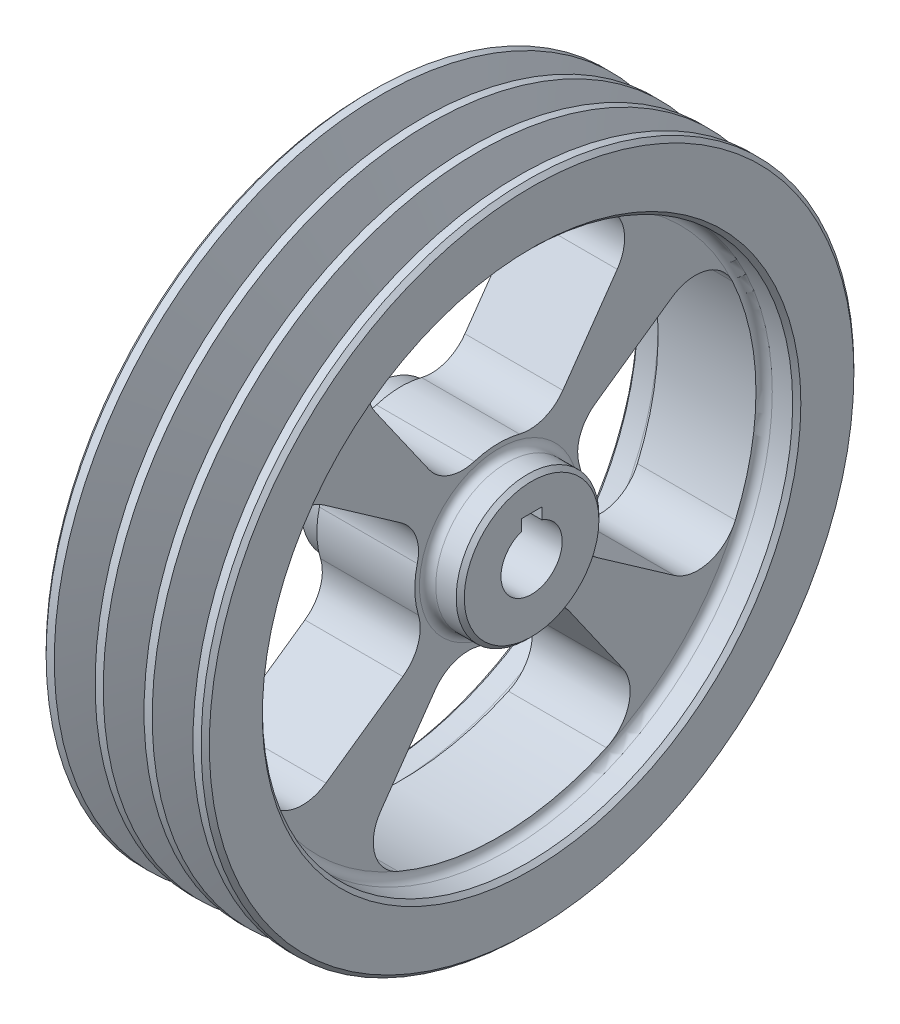
from build123d import *

# Parameters (mm, degrees)
FILLET1_R          = 2
CHAMFER1_SIZE      = 1
CUT_EXTRUDE1_DEPTH = 40
CIRPATTERN1_COUNT  = 4
SKETCH5_W          = 5
SKETCH5_H          = 5
CUT_EXTRUDE2_DEPTH = 121


with BuildPart() as part:
    # Sketch1 → Revolve1 (revolve)
    with BuildSketch(Plane(origin=(0, 0, 0), x_dir=(1, 0, 0), z_dir=(0, 1, 0))):
        Polygon((-12, 17.5), (-12, 65), (-20, 65), (-20, 80), (-17, 80), (-13.942693185, 70), (-10.057306815, 70), (-7, 80), (-5, 80), (-1.942693185, 70), (1.942693185, 70), (5, 80), (7, 80), (10.057306815, 70), (13.942693185, 70), (17, 80), (20, 80), (20, 65), (12, 65), (12, 17.5), (20, 17.5), (20, 7.5), (-20, 7.5), (-20, 17.5), align=None)
    revolve(axis=Axis((0, 0, 0), (-1, 0, 0)))

    # Fillet1
    fillet1_edges = [part.edges().sort_by_distance(p)[0] for p in [
        (-12, 0, 65),
        (-12, 0, 17.5),
        (12, 0, 17.5),
        (12, 0, 65),
    ]]
    fillet(fillet1_edges, radius=FILLET1_R)

    # Chamfer1
    chamfer1_edges = [part.edges().sort_by_distance(p)[0] for p in [
        (-20, 0, 17.5),
        (20, 0, 17.5),
        (20, 0, 65),
        (20, 0, 80),
        (-20, 0, 80),
        (-20, 0, 65),
    ]]
    chamfer(chamfer1_edges, length=CHAMFER1_SIZE)

    # Sketch4 → Cut-Extrude1 (cut)
    with BuildSketch(Plane(origin=(12, 0, 0), x_dir=(0, 0, -1), z_dir=(1, 0, 0))):
        with BuildLine():
            Line((-17.153489429, 23.561464434), (-30.350970096, 42.409420142))
            ThreePointArc((-30.350970096, 42.409420142), (-31.81223798, 50.757401478), (-26.340477889, 57.229181582))
            ThreePointArc((-26.340477889, 57.229181582), (-0.883337908, 62.993806951), (24.725431038, 57.945259167))
            ThreePointArc((24.725431038, 57.945259167), (30.415972368, 51.494903196), (28.992279888, 43.011834619))
            Line((28.992279888, 43.011834619), (15.663534482, 23.976413435))
            ThreePointArc((15.663534482, 23.976413435), (10.964602801, 20.341915063), (5.033152704, 20.01413906))
            ThreePointArc((5.033152704, 20.01413906), (-0.520914556, 20.630730391), (-6.036787164, 19.734629188))
            ThreePointArc((-6.036787164, 19.734629188), (-12.216926377, 19.841793727), (-17.153489429, 23.561464434))
        make_face()
    cut_extrude1 = extrude(amount=-CUT_EXTRUDE1_DEPTH, mode=Mode.SUBTRACT)

    # CirPattern1: Cut-Extrude1 ×4 about axis
    cirpattern1_axis = Axis((0, 0, 0), (1, 0, 0))
    for i in range(1, CIRPATTERN1_COUNT):
        add(cut_extrude1.rotate(cirpattern1_axis, i * 360 / CIRPATTERN1_COUNT), mode=Mode.SUBTRACT)

    # Sketch5 → Cut-Extrude2 (cut, through all)
    with BuildSketch(Plane(origin=(20, 0, 0), x_dir=(0, 0, -1), z_dir=(1, 0, 0))):
        with Locations((0, 7.3)):
            Rectangle(SKETCH5_W, SKETCH5_H)
    extrude(amount=-CUT_EXTRUDE2_DEPTH, mode=Mode.SUBTRACT)


solid = part.part
